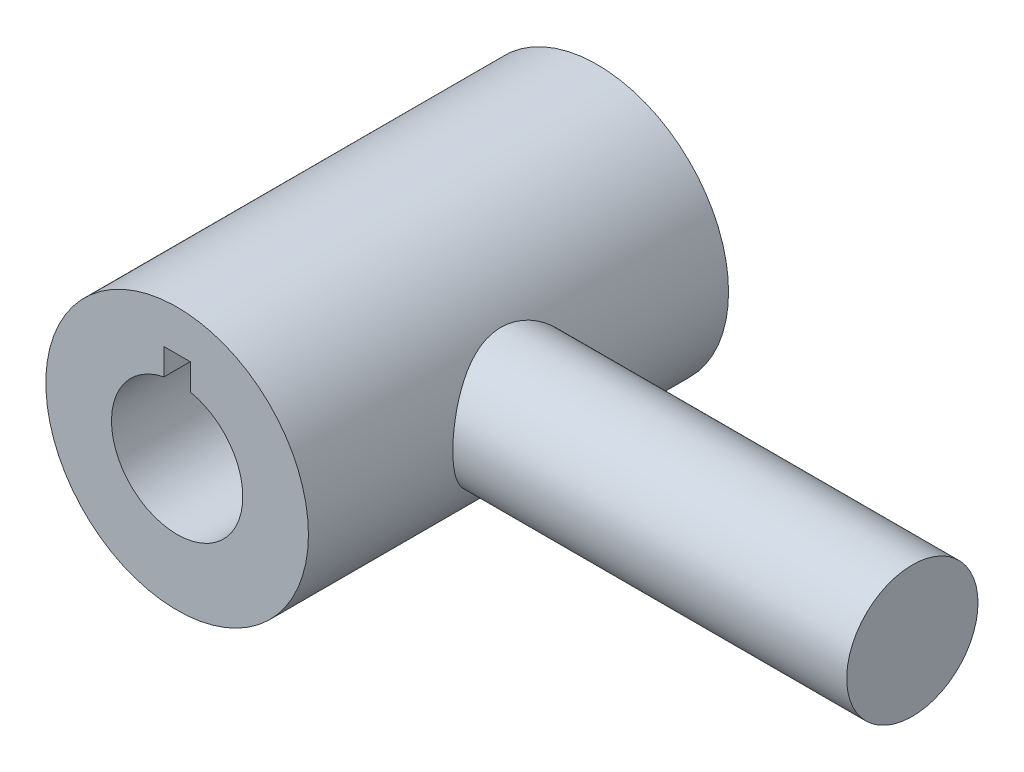
from build123d import *

# Parameters (mm, degrees)
SKETCH1_R                = 6.35
BOSS_EXTRUDE1_DEPTH      = 10.16
BOSS_EXTRUDE2_REACH      = 35.935
BOSS_EXTRUDE2_END_RADIUS = 6.35
SKETCH2_R                = 3.175


with BuildPart() as part:
    # Sketch1 → Boss-Extrude1 (new, symmetric)
    with BuildSketch(Plane.XY):
        Circle(SKETCH1_R)
        with BuildLine():
            Line((-0.635, 3.110851973), (-0.635, 4.380851973))
            Line((-0.635, 4.380851973), (0.635, 4.380851973))
            Line((0.635, 4.380851973), (0.635, 3.110851973))
            ThreePointArc((0.635, 3.110851973), (0, -3.175), (-0.635, 3.110851973))
        make_face(mode=Mode.SUBTRACT)
    extrude(amount=BOSS_EXTRUDE1_DEPTH, both=True)

    # Boss-Extrude2: up to this cylinder (the profile starts outside it)
    boss_extrude2_end = Plane(origin=(0, 0, 0), z_dir=(0, 0, -1)) * Cylinder(BOSS_EXTRUDE2_END_RADIUS, 85.57, mode=Mode.PRIVATE)
    # Sketch2 → Boss-Extrude2 (add, up to the surface)
    with BuildSketch(Plane(origin=(25.4, 0, 0), x_dir=(0, 0, -1), z_dir=(1, 0, 0)), mode=Mode.PRIVATE) as boss_extrude2_sk1:
        Circle(SKETCH2_R)
    boss_extrude2_tool1 = extrude(boss_extrude2_sk1.sketch, amount=-BOSS_EXTRUDE2_REACH, mode=Mode.PRIVATE) - boss_extrude2_end
    add(boss_extrude2_tool1.solids().sort_by_distance((25.4, 0, 0))[0])


solid = part.part
